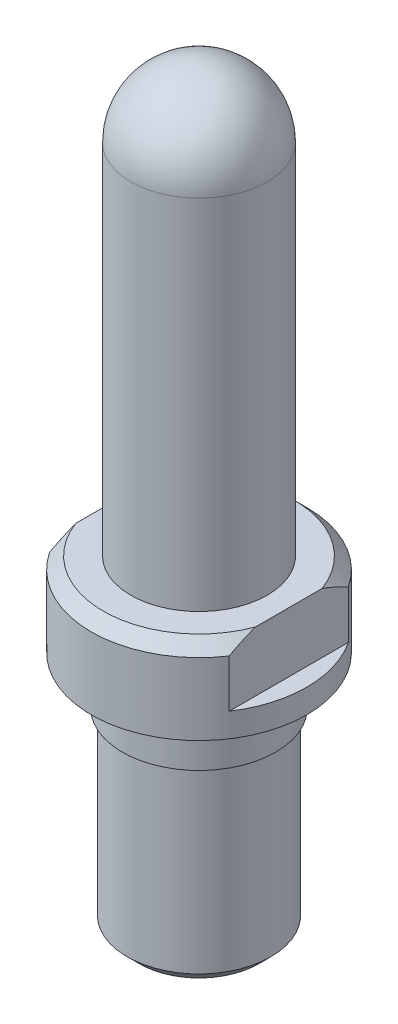
from build123d import *

# Parameters (mm, degrees)
SKETCH3_W          = 2
SKETCH3_H          = 3
CUT_EXTRUDE1_DEPTH = 32.940413272
CHAMFER1_SIZE      = 0.5


with BuildPart() as part:
    # Sketch2 → Revolve1 (revolve)
    with BuildSketch(Plane.XY):
        with BuildLine():
            Line((0, 0), (0, 31.3))
            ThreePointArc((0, 31.3), (2.015254326, 30.465254326), (2.85, 28.45))
            Line((2.85, 28.45), (2.85, 13.5))
            Line((2.85, 13.5), (4, 13.5))
            Line((4, 13.5), (4.5, 13))
            Line((4.5, 13), (4.5, 10))
            Line((4.5, 10), (3.2, 10))
            Line((3.2, 10), (3.2, 8))
            Line((3.2, 8), (3, 8))
            Line((3, 8), (3, 0))
            Line((3, 0), (0, 0))
        make_face()
    revolve(axis=Axis((0, 0, 0), (0, 1, 0)))

    # Sketch3 → Cut-Extrude1 (cut, symmetric)
    with BuildSketch(Plane.XY):
        with Locations((-4.75, 12.5)):
            Rectangle(SKETCH3_W, SKETCH3_H)
    cut_extrude1 = extrude(amount=CUT_EXTRUDE1_DEPTH, both=True, mode=Mode.SUBTRACT)

    # Mirror1: Cut-Extrude1 across plane
    add(cut_extrude1.mirror(Plane(origin=(0, 0, 0), x_dir=(0, 0, 1), z_dir=(1, 0, 0))), mode=Mode.SUBTRACT)

    # Chamfer1
    chamfer1_edges = [part.edges().sort_by_distance(p)[0] for p in [
        (-3, 0, 0),
    ]]
    chamfer(chamfer1_edges, length=CHAMFER1_SIZE)


solid = part.part
